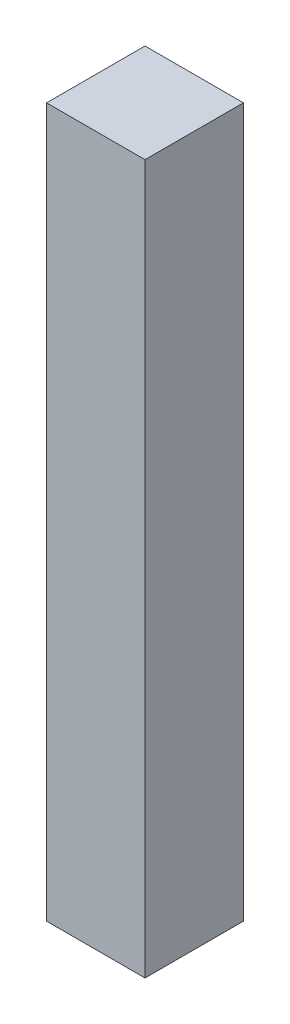
from build123d import *

# Parameters (mm, degrees)
SKETCH1_W           = 100
SKETCH1_H           = 100
BOSS_EXTRUDE1_DEPTH = 720


with BuildPart() as part:
    # Sketch1 → Boss-Extrude1 (new body)
    with BuildSketch(Plane(origin=(0, 0, 0), x_dir=(1, 0, 0), z_dir=(0, 1, 0))):
        Rectangle(SKETCH1_W, SKETCH1_H)
    extrude(amount=BOSS_EXTRUDE1_DEPTH)


solid = part.part
